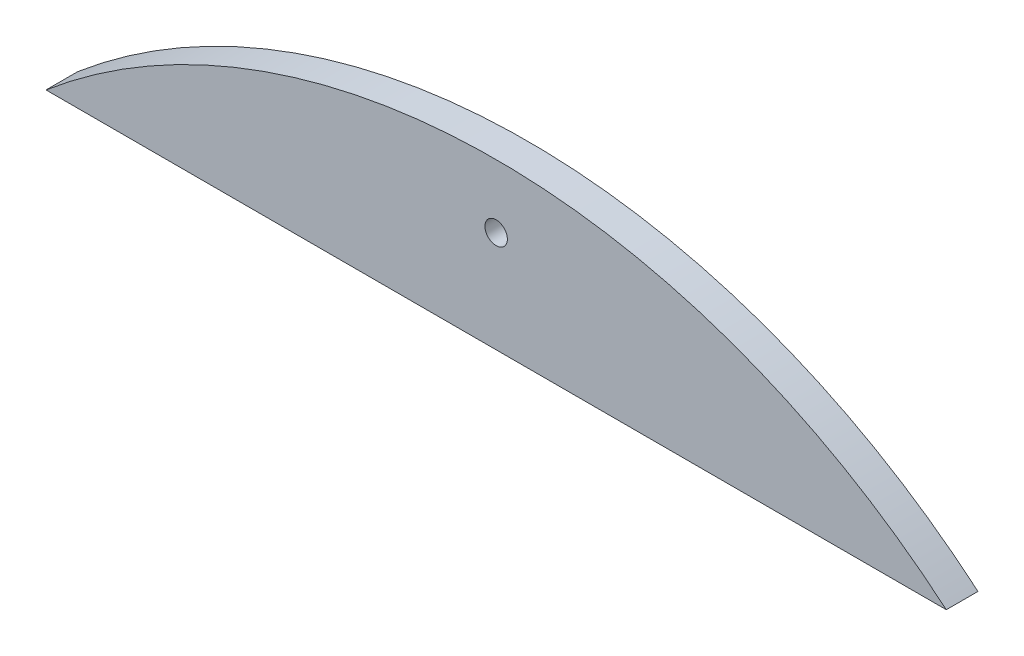
from build123d import *

# Parameters (mm, degrees)
BOSS_EXTRUDE1_DEPTH   = 6.35
F_8_CLEARANCE_HOLE1_D = 4.4958


with BuildPart() as part:
    # Sketch1 → Boss-Extrude1 (new body)
    with BuildSketch(Plane.XY):
        with BuildLine():
            ThreePointArc((90.196826995, 106.68), (0, 139.7), (-90.196826995, 106.68))
            Line((-90.196826995, 106.68), (90.196826995, 106.68))
        make_face()
    extrude(amount=BOSS_EXTRUDE1_DEPTH)

    # #8 Clearance Hole1 (through all)
    with Locations(Plane.XY.offset(6.35)):
        with Locations((0, 127)):
            Hole(F_8_CLEARANCE_HOLE1_D / 2)


solid = part.part
